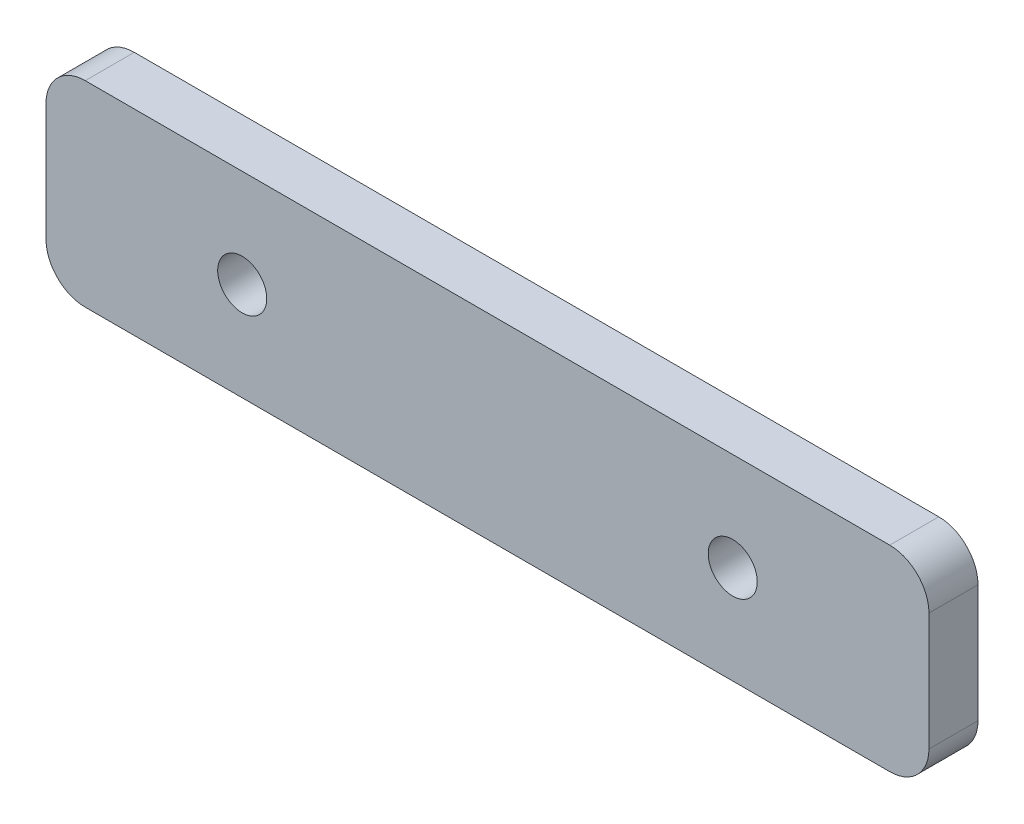
from build123d import *

# Parameters (mm, degrees)
SKETCH1_W           = 57.15
SKETCH1_H           = 12.7
SKETCH1_R           = 1.5875
BOSS_EXTRUDE1_DEPTH = 3.175
FILLET1_R           = 2.54


with BuildPart() as part:
    # Sketch1 → Boss-Extrude1 (new body)
    with BuildSketch(Plane.XY):
        Rectangle(SKETCH1_W, SKETCH1_H)
        with Locations((-15.875, 0)):
            Circle(SKETCH1_R, mode=Mode.SUBTRACT)
        with Locations((15.875, 0)):
            Circle(SKETCH1_R, mode=Mode.SUBTRACT)
    extrude(amount=BOSS_EXTRUDE1_DEPTH)

    # Fillet1
    fillet1_edges = [part.edges().sort_by_distance(p)[0] for p in [
        (28.575, -6.35, 1.5875),
        (-28.575, -6.35, 1.5875),
        (-28.575, 6.35, 1.5875),
        (28.575, 6.35, 1.5875),
    ]]
    fillet(fillet1_edges, radius=FILLET1_R)


solid = part.part
